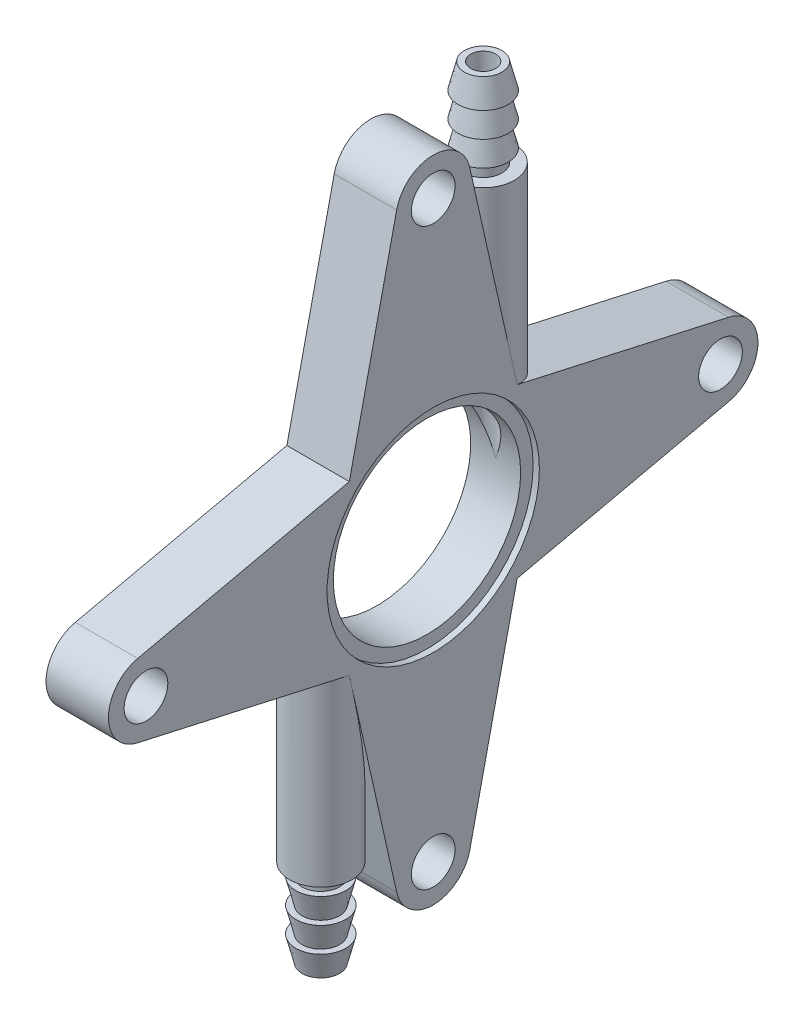
from build123d import *

# Parameters (mm, degrees)
SKETCH2_R           = 1.75
SKETCH2_R_2         = 7.5
FLANGE_DEPTH        = 5
SKETCH3_R           = 8.5
O_RING_SEAT_DEPTH   = 0.5
SKETCH5_R           = 1
OUTLET_DEPTH        = 38.107950631
BOSS_EXTRUDE2_REACH = 55.944
SKETCH6_R           = 2.5
SKETCH6_R_2         = 1
CIRPATTERN1_COUNT   = 2


with BuildPart() as part:
    # Sketch2 → Flange (new body)
    with BuildSketch(Plane(origin=(0, 0, 0), x_dir=(0, 0, -1), z_dir=(1, 0, 0))):
        with BuildLine():
            Line((-6.717514421, 6.717514421), (-2.92760615, 23.655074219))
            ThreePointArc((-2.92760615, 23.655074219), (0, 26), (2.92760615, 23.655074219))
            Line((2.92760615, 23.655074219), (6.717514421, 6.717514421))
            Line((6.717514421, 6.717514421), (23.655074219, 2.92760615))
            ThreePointArc((23.655074219, 2.92760615), (26, 0), (23.655074219, -2.92760615))
            Line((23.655074219, -2.92760615), (6.717514421, -6.717514421))
            Line((6.717514421, -6.717514421), (2.92760615, -23.655074219))
            ThreePointArc((2.92760615, -23.655074219), (0, -26), (-2.92760615, -23.655074219))
            Line((-2.92760615, -23.655074219), (-6.717514421, -6.717514421))
            Line((-6.717514421, -6.717514421), (-23.655074219, -2.92760615))
            ThreePointArc((-23.655074219, -2.92760615), (-26, 0), (-23.655074219, 2.92760615))
            Line((-23.655074219, 2.92760615), (-6.717514421, 6.717514421))
        make_face()
        with Locations((0, 23)):
            Circle(SKETCH2_R, mode=Mode.SUBTRACT)
        with Locations((23, 0)):
            Circle(SKETCH2_R, mode=Mode.SUBTRACT)
        with Locations((0, -23)):
            Circle(SKETCH2_R, mode=Mode.SUBTRACT)
        with Locations((-23, 0)):
            Circle(SKETCH2_R, mode=Mode.SUBTRACT)
        Circle(SKETCH2_R_2, mode=Mode.SUBTRACT)
    extrude(amount=FLANGE_DEPTH)

    # Sketch3 → O-Ring Seat (cut)
    with BuildSketch(Plane(origin=(5, 0, 0), x_dir=(0, 0, -1), z_dir=(1, 0, 0))):
        Circle(SKETCH3_R)
    o_ring_seat = extrude(amount=-O_RING_SEAT_DEPTH, mode=Mode.SUBTRACT)

    # Mirror1: O-Ring Seat across plane
    add(o_ring_seat.mirror(Plane(origin=(2.5, 0, 0), x_dir=(0, 0, 1), z_dir=(1, 0, 0))), mode=Mode.SUBTRACT)

    # Sketch5 → Outlet (cut, through all)
    with BuildSketch(Plane(origin=(0, 0, 0), x_dir=(1, 0, 0), z_dir=(0, 1, 0))):
        with Locations(Location((2.5, 6.5, 0), (0, 0, 90))):
            Circle(SKETCH5_R)
    outlet = extrude(amount=OUTLET_DEPTH, mode=Mode.SUBTRACT)

    # Sketch6 → Boss-Extrude2 (add, up to next)
    with BuildSketch(Plane(origin=(0, 21, 0), x_dir=(1, 0, 0), z_dir=(0, 1, 0)), mode=Mode.PRIVATE) as boss_extrude2_sk1:
        with Locations(Location((2.5, 6.5, 0), (0, 0, 270))):
            Circle(SKETCH6_R)
        with Locations(Location((2.5, 6.5, 0), (0, 0, 90))):
            Circle(SKETCH6_R_2, mode=Mode.SUBTRACT)
    boss_extrude2_tool1 = extrude(boss_extrude2_sk1.sketch, amount=-BOSS_EXTRUDE2_REACH, mode=Mode.PRIVATE) - part.part
    boss_extrude2 = boss_extrude2_tool1.solids().sort_by_distance((2.5, 21, -8.929289))[0]
    add(boss_extrude2)

    # Sketch8 → Revolve1 (revolve)
    with BuildSketch(Plane(origin=(2.5, 0, 0), x_dir=(0, 0, -1), z_dir=(1, 0, 0))):
        Polygon((5, 21), (5, 22), (4.5, 22), (5, 24), (4.5, 24), (5, 26), (4.5, 26), (5, 28), (5.5, 28), (5.5, 21), align=None)
    revolve1 = revolve(axis=Axis((2.5, 26, -6.5), (0, -1, 0)))

    # CirPattern1: Outlet, Boss-Extrude2, Revolve1 ×2 about axis
    cirpattern1_axis = Axis((0.5, 0, 0), (-1, 0, 0))
    add([outlet.rotate(cirpattern1_axis, i * 360 / CIRPATTERN1_COUNT) for i in range(1, CIRPATTERN1_COUNT)], mode=Mode.SUBTRACT)
    add([boss_extrude2.rotate(cirpattern1_axis, i * 360 / CIRPATTERN1_COUNT) for i in range(1, CIRPATTERN1_COUNT)])
    add([revolve1.rotate(cirpattern1_axis, i * 360 / CIRPATTERN1_COUNT) for i in range(1, CIRPATTERN1_COUNT)])


solid = part.part
